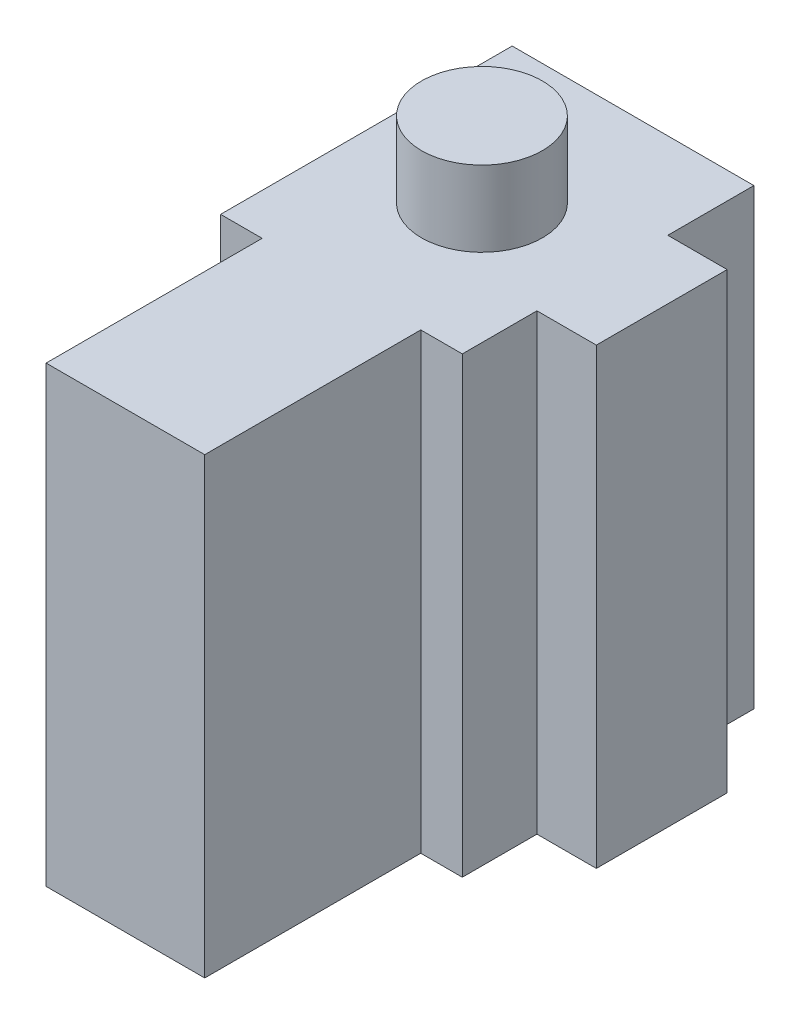
from build123d import *

# Parameters (mm, degrees)
BOSS_EXTRUDE1_DEPTH = 7.62
SKETCH2_R           = 1.016
BOSS_EXTRUDE2_DEPTH = 1.27


with BuildPart() as part:
    # Sketch1 → Boss-Extrude1 (new body)
    with BuildSketch(Plane(origin=(0, 0, 0), x_dir=(1, 0, 0), z_dir=(0, 1, 0))):
        Polygon((0, 1.681040649), (0, 0), (0, -1.951159351), (2.667, -1.951159351), (2.667, 1.681040649), (3.3655, 1.681040649), (3.3655, 2.935800649), (4.36372, 2.935800649), (4.36372, 5.135440649), (3.3655, 5.135440649), (3.3655, 6.583240649), (-0.6985, 6.583240649), (-0.6985, 1.681040649), align=None)
    extrude(amount=BOSS_EXTRUDE1_DEPTH)

    # Sketch2 → Boss-Extrude2 (add)
    with BuildSketch(Plane(origin=(0, 7.62, 0), x_dir=(1, 0, 0), z_dir=(0, 1, 0))):
        with Locations(Location((1.3335, 4.043240649, 0), (0, 0, 270))):
            Circle(SKETCH2_R)
    extrude(amount=BOSS_EXTRUDE2_DEPTH)


solid = part.part
